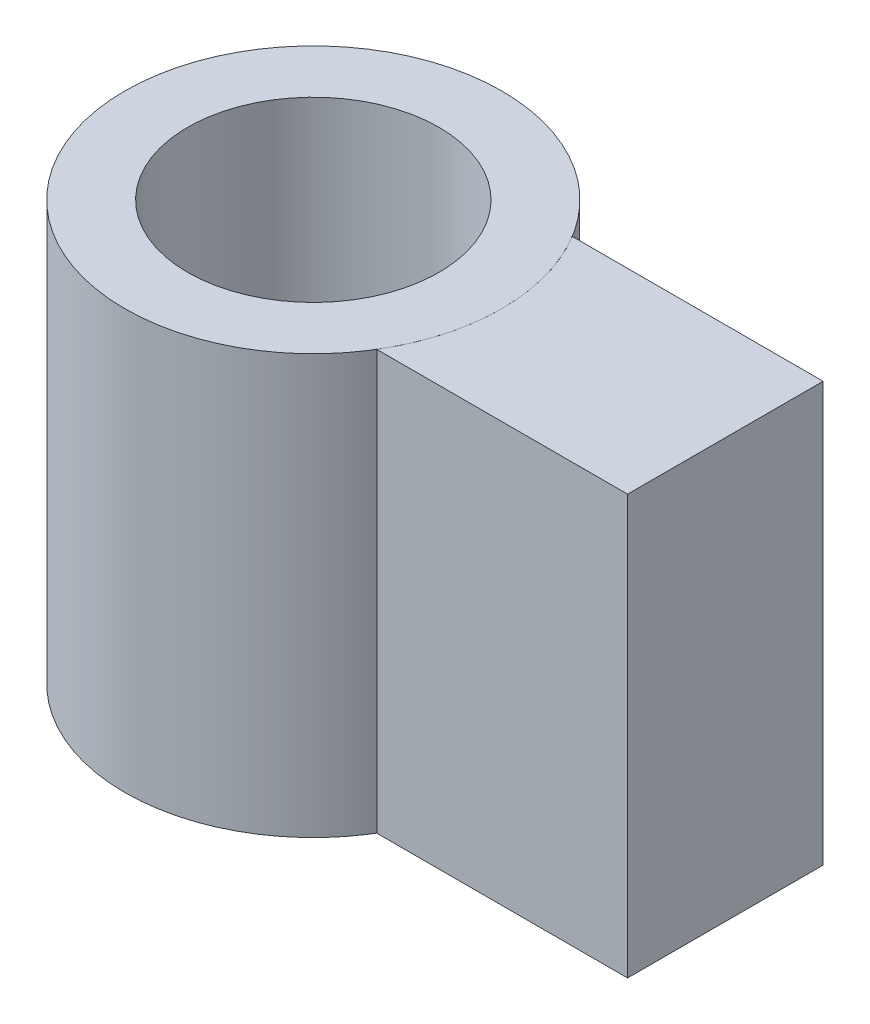
from build123d import *

# Parameters (mm, degrees)
SKETCH1_R                = 13.5
BOSS_EXTRUDE1_DEPTH      = 30
SKETCH2_R                = 9
CUT_EXTRUDE1_DEPTH       = 36.559808773
BOSS_EXTRUDE3_REACH      = 56.141
BOSS_EXTRUDE3_END_RADIUS = 13.5
SKETCH3_W                = 14
SKETCH3_H                = 30


with BuildPart() as part:
    # Sketch1 → Boss-Extrude1 (new body)
    with BuildSketch(Plane(origin=(0, 0, 0), x_dir=(1, 0, 0), z_dir=(0, 1, 0))):
        with Locations(Location((0, 0, 0), (0, 0, 270))):
            Circle(SKETCH1_R)
    extrude(amount=-BOSS_EXTRUDE1_DEPTH)

    # Sketch2 → Cut-Extrude1 (cut, through all)
    with BuildSketch(Plane(origin=(0, 0, 0), x_dir=(1, 0, 0), z_dir=(0, 1, 0))):
        with Locations(Location((0, 0, 0), (0, 0, 270))):
            Circle(SKETCH2_R)
    extrude(amount=-CUT_EXTRUDE1_DEPTH, mode=Mode.SUBTRACT)


with BuildPart() as body_2:
    # Boss-Extrude3: up to this cylinder (the profile starts outside it)
    boss_extrude3_end = Plane(origin=(0, -15, 0), z_dir=(0, 1, 0)) * Cylinder(BOSS_EXTRUDE3_END_RADIUS, 140.282, mode=Mode.PRIVATE)
    # Sketch3 → Boss-Extrude3 (new, up to the surface)
    with BuildSketch(Plane(origin=(29.5, 0, 0), x_dir=(0, 0, -1), z_dir=(1, 0, 0)), mode=Mode.PRIVATE) as boss_extrude3_sk1:
        with Locations((0, -15)):
            Rectangle(SKETCH3_W, SKETCH3_H)
    boss_extrude3_tool1 = extrude(boss_extrude3_sk1.sketch, amount=-BOSS_EXTRUDE3_REACH, mode=Mode.PRIVATE) - boss_extrude3_end
    add(boss_extrude3_tool1.solids().sort_by_distance((29.5, -15, 0))[0])


solid = Compound([part.part, body_2.part])
